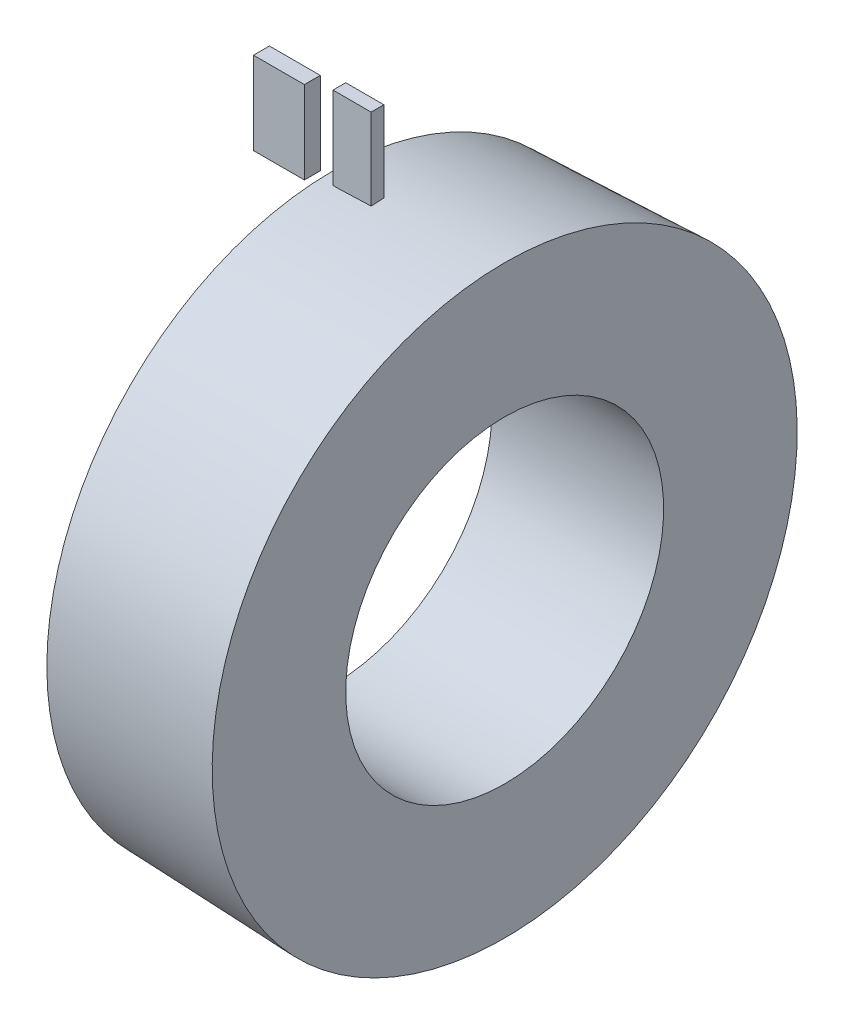
from build123d import *

# Parameters (mm, degrees)
SKETCH1_W           = 80
SKETCH1_H           = 130
BOSS_EXTRUDE1_DEPTH = 25
REVOLVE1_ANGLE      = 359.999999589
SKETCH3_W           = 60
SKETCH3_H           = 130
BOSS_EXTRUDE2_DEPTH = 20


with BuildPart() as part:
    # Sketch1 → Boss-Extrude1 (new body)
    with BuildSketch(Plane.XY):
        with Locations((4420, 505)):
            Rectangle(SKETCH1_W, SKETCH1_H)
    extrude(amount=BOSS_EXTRUDE1_DEPTH)


with BuildPart() as body_2:
    # Sketch2 → Revolve1 (revolve)
    with BuildSketch(Plane.XY):
        Polygon((4480, 250), (4480, 450), (4750, 460), (4750, 250), align=None)
    revolve(axis=Axis((0, 0, 0), (1, 0, 0)), revolution_arc=REVOLVE1_ANGLE)


with BuildPart() as body_3:
    # Sketch3 → Boss-Extrude2 (new body)
    with BuildSketch(Plane.XY):
        with Locations((4530, 515)):
            Rectangle(SKETCH3_W, SKETCH3_H)
    extrude(amount=BOSS_EXTRUDE2_DEPTH)


solid = Compound([part.part, body_2.part, body_3.part])
